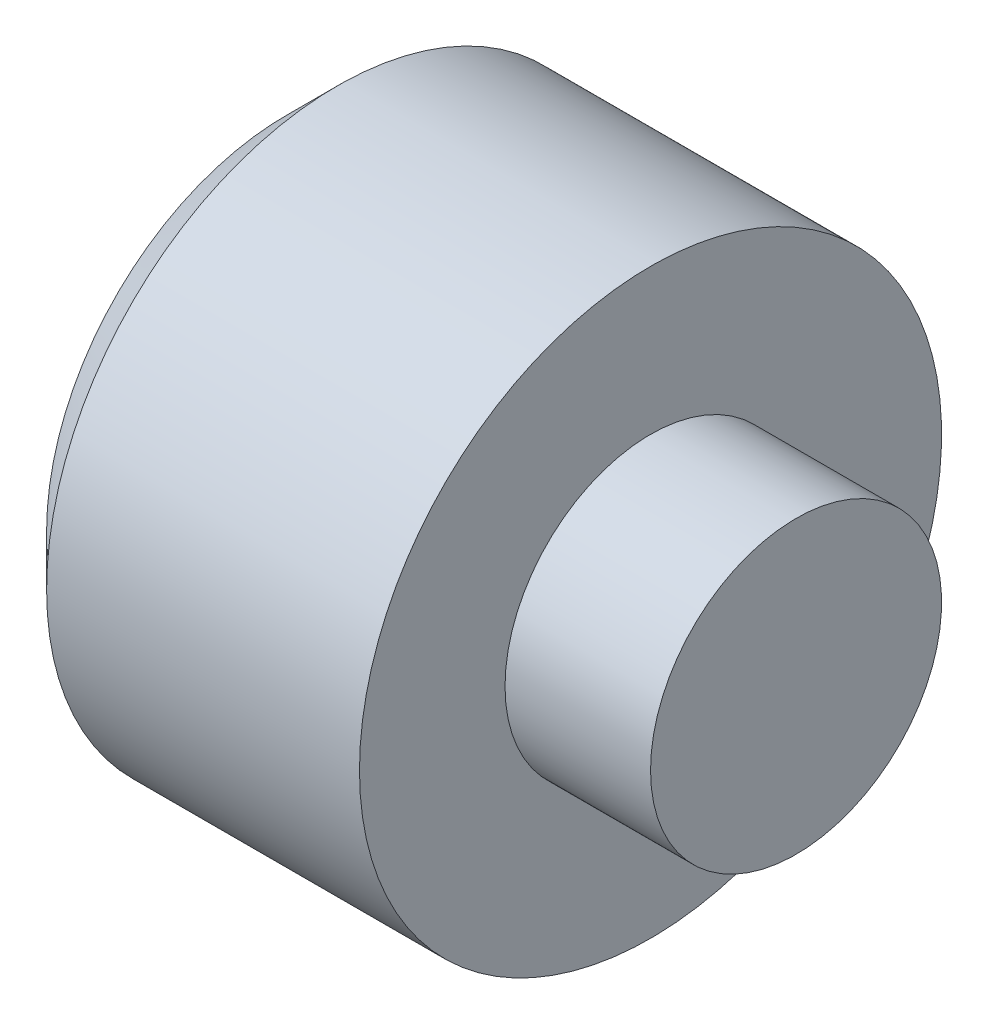
from build123d import *

# Parameters (mm, degrees)
CHANFREIN1_SIZE = 0.7


with BuildPart() as part:
    # Esquisse1 → Base-Révolution (revolve)
    with BuildSketch(Plane.XY, mode=Mode.PRIVATE) as base_r_volution_sk:
        Polygon((0, 0), (0, 4), (5, 4), (5, 2), (7, 2), (7, 0), align=None)
    revolve(base_r_volution_sk.sketch.rotate(Axis((-2, 0, 0), (1, 0, 0)), 90), axis=Axis((-2, 0, 0), (1, 0, 0)))

    # Chanfrein1
    chanfrein1_edges = [part.edges().sort_by_distance(p)[0] for p in [
        (0, 0, -4),
    ]]
    chamfer(chanfrein1_edges, length=CHANFREIN1_SIZE)


solid = part.part
